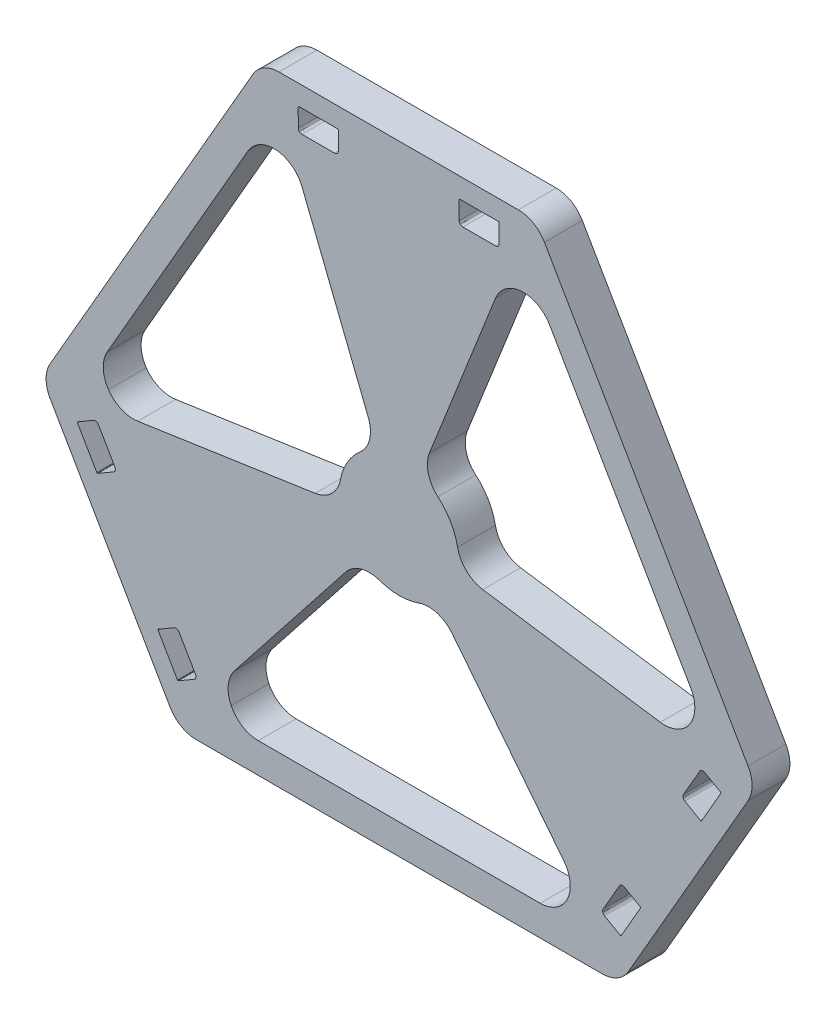
from build123d import *

# Parameters (mm, degrees)
SALIENTE_EXTRUIR1_DEPTH = 6


with BuildPart() as part:
    # Model → Saliente-Extruir1 (new body)
    with BuildSketch(Plane.XY):
        with BuildLine():
            Line((123.073716777, 150.594974991), (155.364474777, 94.802453991))
            add(Edge.make_bspline(
                [(155.369875777, 90.027377991), (156.220958777, 91.506312991), (156.220003777, 93.325664991), (155.364474777, 94.802453991)],
                knots=[0, 0, 0, 0, 1, 1, 1, 1], degree=3))
            Line((155.369875777, 90.027377991), (136.394857777, 57.081100991))
            add(Edge.make_bspline(
                [(132.258746777, 54.689013991), (133.966417777, 54.690033991), (135.542764777, 55.601093991), (136.394857777, 57.081100991)],
                knots=[0, 0, 0, 0, 1, 1, 1, 1], degree=3))
            Line((132.258746777, 54.689013991), (67.838026777, 54.661802991))
            add(Edge.make_bspline(
                [(63.702990777, 57.044915991), (64.557578777, 55.569169991), (66.132444777, 54.660742991), (67.838026777, 54.661802991)],
                knots=[0, 0, 0, 0, 1, 1, 1, 1], degree=3))
            Line((63.702990777, 57.044915991), (44.672617777, 89.925918991))
            add(Edge.make_bspline(
                [(44.667756777, 94.701021991), (43.816363777, 93.221867991), (43.817618777, 91.402648991), (44.672617777, 89.925918991)],
                knots=[0, 0, 0, 0, 1, 1, 1, 1], degree=3))
            Line((44.667756777, 94.701021991), (76.830723777, 150.545823991))
            add(Edge.make_bspline(
                [(80.963762777, 152.938289991), (79.256844777, 152.935967991), (77.682094777, 152.024965991), (76.830723777, 150.545823991)],
                knots=[0, 0, 0, 0, 1, 1, 1, 1], degree=3))
            Line((80.963762777, 152.938289991), (118.935657777, 152.978335991))
            add(Edge.make_bspline(
                [(123.073716777, 150.594974991), (122.218474777, 152.071971991), (120.642270777, 152.980480991), (118.935657777, 152.978335991)],
                knots=[0, 0, 0, 0, 1, 1, 1, 1], degree=3))
        make_face()
        with BuildLine():
            Line((77.681485777, 59.441134991), (122.387310777, 59.459893991))
            add(Edge.make_bspline(
                [(126.697512777, 62.165300991), (125.906296777, 60.516724991), (124.216028777, 59.465862991), (122.387310777, 59.459893991)],
                knots=[0, 0, 0, 0, 1, 1, 1, 1], degree=3))
            add(Edge.make_bspline(
                [(126.128344777, 67.200341991), (127.267996777, 65.769991991), (127.489033777, 63.814052991), (126.697512777, 62.165300991)],
                knots=[0, 0, 0, 0, 1, 1, 1, 1], degree=3))
            Line((126.128344777, 67.200341991), (108.441737777, 89.527436991))
            add(Edge.make_bspline(
                [(103.127906777, 91.071743991), (105.046522777, 91.740738991), (107.179880777, 91.119636991), (108.441737777, 89.527436991)],
                knots=[0, 0, 0, 0, 1, 1, 1, 1], degree=3))
            add(Edge.make_bspline(
                [(96.876021777, 91.081033991), (98.899345777, 90.369754991), (101.102765777, 90.366368991), (103.127906777, 91.071743991)],
                knots=[0, 0, 0, 0, 1, 1, 1, 1], degree=3))
            add(Edge.make_bspline(
                [(91.541311777, 89.530966991), (92.803750777, 91.135114991), (94.949988777, 91.757318991), (96.876021777, 91.081033991)],
                knots=[0, 0, 0, 0, 1, 1, 1, 1], degree=3))
            Line((91.541311777, 89.530966991), (73.928138777, 67.171368991))
            add(Edge.make_bspline(
                [(73.382054777, 62.115712991), (72.579715777, 63.757020991), (72.801400777, 65.732986991), (73.928138777, 67.171368991)],
                knots=[0, 0, 0, 0, 1, 1, 1, 1], degree=3))
            add(Edge.make_bspline(
                [(77.681485777, 59.441134991), (75.854393777, 59.435455991), (74.184692777, 60.474168991), (73.382054777, 62.115712991)],
                knots=[0, 0, 0, 0, 1, 1, 1, 1], degree=3))
        make_face(mode=Mode.SUBTRACT)
        with BuildLine():
            Line((58.568705777, 93.763253991), (86.715953777, 97.930982991))
            add(Edge.make_bspline(
                [(90.708621777, 101.767455991), (90.331813777, 99.769779991), (88.727234777, 98.229294991), (86.715953777, 97.930982991)],
                knots=[0, 0, 0, 0, 1, 1, 1, 1], degree=3))
            add(Edge.make_bspline(
                [(93.823645777, 107.175973991), (92.203805777, 105.776652991), (91.105979777, 103.871180991), (90.708621777, 101.767455991)],
                knots=[0, 0, 0, 0, 1, 1, 1, 1], degree=3))
            add(Edge.make_bspline(
                [(95.138871777, 112.555316991), (95.891105777, 110.666125991), (95.361735777, 108.505969991), (93.823645777, 107.175973991)],
                knots=[0, 0, 0, 0, 1, 1, 1, 1], degree=3))
            Line((95.138871777, 112.555316991), (84.617766777, 138.992746991))
            add(Edge.make_bspline(
                [(80.511673777, 141.999081991), (82.336308777, 141.872661991), (83.936995777, 140.690148991), (84.617766777, 138.992746991)],
                knots=[0, 0, 0, 0, 1, 1, 1, 1], degree=3))
            add(Edge.make_bspline(
                [(76.043299777, 139.610630991), (76.951616777, 141.197728991), (78.687519777, 142.125372991), (80.511673777, 141.999081991)],
                knots=[0, 0, 0, 0, 1, 1, 1, 1], degree=3))
            Line((76.043299777, 139.610630991), (53.731287777, 100.870303991))
            add(Edge.make_bspline(
                [(53.922329777, 95.784755991), (52.889274777, 97.293756991), (52.822817777, 99.283116991), (53.731287777, 100.870303991)],
                knots=[0, 0, 0, 0, 1, 1, 1, 1], degree=3))
            add(Edge.make_bspline(
                [(58.568705777, 93.763253991), (56.760289777, 93.490642991), (54.955385777, 94.275754991), (53.922329777, 95.784755991)],
                knots=[0, 0, 0, 0, 1, 1, 1, 1], degree=3))
        make_face(mode=Mode.SUBTRACT)
        with BuildLine():
            Line((115.310927777, 139.025350991), (104.846212777, 112.565382991))
            add(Edge.make_bspline(
                [(106.176293777, 107.186096991), (104.631705777, 108.511130991), (104.098507777, 110.672605991), (104.846212777, 112.565382991)],
                knots=[0, 0, 0, 0, 1, 1, 1, 1], degree=3))
            add(Edge.make_bspline(
                [(109.300161777, 101.815386991), (108.892803777, 103.906624991), (107.793166777, 105.798143991), (106.176293777, 107.186096991)],
                knots=[0, 0, 0, 0, 1, 1, 1, 1], degree=3))
            add(Edge.make_bspline(
                [(113.291110777, 98.003018991), (111.287236777, 98.297572991), (109.687303777, 99.827392991), (109.300161777, 101.815386991)],
                knots=[0, 0, 0, 0, 1, 1, 1, 1], degree=3))
            Line((113.291110777, 98.003018991), (141.449392777, 93.852301991))
            add(Edge.make_bspline(
                [(146.110980777, 95.901281991), (145.087483777, 94.384311991), (143.260657777, 93.590523991), (141.449392777, 93.852301991)],
                knots=[0, 0, 0, 0, 1, 1, 1, 1], degree=3))
            add(Edge.make_bspline(
                [(146.278499777, 100.968458991), (147.199723777, 99.387315991), (147.134406777, 97.418372991), (146.110980777, 95.901281991)],
                knots=[0, 0, 0, 0, 1, 1, 1, 1], degree=3))
            Line((146.278499777, 100.968458991), (123.884522777, 139.661154991))
            add(Edge.make_bspline(
                [(119.384710777, 142.038537991), (121.208225777, 142.178856991), (122.964168777, 141.241496991), (123.884522777, 139.661154991)],
                knots=[0, 0, 0, 0, 1, 1, 1, 1], degree=3))
            add(Edge.make_bspline(
                [(115.310927777, 139.025350991), (115.979211777, 140.727870991), (117.561501777, 141.898395991), (119.384710777, 142.038537991)],
                knots=[0, 0, 0, 0, 1, 1, 1, 1], degree=3))
        make_face(mode=Mode.SUBTRACT)
        with BuildLine():
            Line((64.328403777, 68.276009991), (61.844260777, 66.838274991))
            add(Edge.make_bspline(
                [(61.785234777, 66.760906991), (61.793733777, 66.793542991), (61.815163777, 66.821434991), (61.844260777, 66.838274991)],
                knots=[0, 0, 0, 0, 1, 1, 1, 1], degree=3))
            add(Edge.make_bspline(
                [(61.797916777, 66.664715991), (61.781129777, 66.693721991), (61.776736777, 66.728271991), (61.785234777, 66.760906991)],
                knots=[0, 0, 0, 0, 1, 1, 1, 1], degree=3))
            Line((61.797916777, 66.664715991), (64.851513777, 61.388659991))
            add(Edge.make_bspline(
                [(64.928897777, 61.329507991), (64.896246777, 61.338328991), (64.868596777, 61.359417991), (64.851513777, 61.388659991)],
                knots=[0, 0, 0, 0, 1, 1, 1, 1], degree=3))
            add(Edge.make_bspline(
                [(65.025090777, 61.342383991), (64.995992777, 61.325542991), (64.961547777, 61.320687991), (64.928897777, 61.329507991)],
                knots=[0, 0, 0, 0, 1, 1, 1, 1], degree=3))
            Line((65.025090777, 61.342383991), (67.509233777, 62.780118991))
            add(Edge.make_bspline(
                [(67.781432777, 63.135344991), (67.741531777, 62.985894991), (67.643272777, 62.857695991), (67.509233777, 62.780118991)],
                knots=[0, 0, 0, 0, 1, 1, 1, 1], degree=3))
            add(Edge.make_bspline(
                [(67.722280777, 63.578411991), (67.799857777, 63.444373991), (67.821187777, 63.285117991), (67.781432777, 63.135344991)],
                knots=[0, 0, 0, 0, 1, 1, 1, 1], degree=3))
            Line((67.722280777, 63.578411991), (65.126723777, 68.063059991))
            add(Edge.make_bspline(
                [(64.771379777, 68.335109991), (64.921141777, 68.295021991), (65.049024777, 68.197027991), (65.126723777, 68.063059991)],
                knots=[0, 0, 0, 0, 1, 1, 1, 1], degree=3))
            add(Edge.make_bspline(
                [(64.328403777, 68.276009991), (64.462442777, 68.353586991), (64.621763777, 68.374873991), (64.771379777, 68.335109991)],
                knots=[0, 0, 0, 0, 1, 1, 1, 1], degree=3))
        make_face(mode=Mode.SUBTRACT)
        with BuildLine():
            Line((51.541468777, 90.369494991), (49.057325777, 88.931759991))
            add(Edge.make_bspline(
                [(48.998299777, 88.854391991), (49.006797777, 88.887026991), (49.028227777, 88.914918991), (49.057325777, 88.931759991)],
                knots=[0, 0, 0, 0, 1, 1, 1, 1], degree=3))
            add(Edge.make_bspline(
                [(49.010981777, 88.758200991), (48.994193777, 88.787206991), (48.989505777, 88.821991991), (48.998299777, 88.854391991)],
                knots=[0, 0, 0, 0, 1, 1, 1, 1], degree=3))
            Line((49.010981777, 88.758200991), (52.064578777, 83.482144991))
            add(Edge.make_bspline(
                [(52.141842777, 83.422923991), (52.109488777, 83.431507991), (52.081542777, 83.452832991), (52.064578777, 83.482144991)],
                knots=[0, 0, 0, 0, 1, 1, 1, 1], degree=3))
            add(Edge.make_bspline(
                [(52.238155777, 83.435867991), (52.209057777, 83.419026991), (52.174435777, 83.414477991), (52.141842777, 83.422923991)],
                knots=[0, 0, 0, 0, 1, 1, 1, 1], degree=3))
            Line((52.238155777, 83.435867991), (54.722298777, 84.873602991))
            add(Edge.make_bspline(
                [(54.994497777, 85.228829991), (54.954474777, 85.079308991), (54.856337777, 84.951179991), (54.722298777, 84.873602991)],
                knots=[0, 0, 0, 0, 1, 1, 1, 1], degree=3))
            add(Edge.make_bspline(
                [(54.935345777, 85.671896991), (55.012922777, 85.537857991), (55.034252777, 85.378602991), (54.994497777, 85.228829991)],
                knots=[0, 0, 0, 0, 1, 1, 1, 1], degree=3))
            Line((54.935345777, 85.671896991), (52.339788777, 90.156543991))
            add(Edge.make_bspline(
                [(51.984444777, 90.428593991), (52.134029777, 90.388811991), (52.262265777, 90.290206991), (52.339788777, 90.156543991)],
                knots=[0, 0, 0, 0, 1, 1, 1, 1], degree=3))
            add(Edge.make_bspline(
                [(51.541468777, 90.369494991), (51.675507777, 90.447071991), (51.834828777, 90.468358991), (51.984444777, 90.428593991)],
                knots=[0, 0, 0, 0, 1, 1, 1, 1], degree=3))
        make_face(mode=Mode.SUBTRACT)
        with BuildLine():
            Line((115.904166777, 146.807848991), (115.901119777, 149.678052991))
            add(Edge.make_bspline(
                [(115.863692777, 149.768074991), (115.887277777, 149.744225991), (115.901108777, 149.711877991), (115.901119777, 149.678052991)],
                knots=[0, 0, 0, 0, 1, 1, 1, 1], degree=3))
            add(Edge.make_bspline(
                [(115.773874777, 149.804947991), (115.807521777, 149.805264991), (115.839801777, 149.791746991), (115.863692777, 149.768074991)],
                knots=[0, 0, 0, 0, 1, 1, 1, 1], degree=3))
            Line((115.773874777, 149.804947991), (109.677852777, 149.798469991))
            add(Edge.make_bspline(
                [(109.588136777, 149.761218991), (109.611808777, 149.785109991), (109.644028777, 149.798457991), (109.677852777, 149.798469991)],
                knots=[0, 0, 0, 0, 1, 1, 1, 1], degree=3))
            add(Edge.make_bspline(
                [(109.550957777, 149.671223991), (109.550946777, 149.705047991), (109.564158777, 149.737150991), (109.588136777, 149.761218991)],
                knots=[0, 0, 0, 0, 1, 1, 1, 1], degree=3))
            Line((109.550957777, 149.671223991), (109.554004777, 146.801019991))
            add(Edge.make_bspline(
                [(109.725753777, 146.388065991), (109.616019777, 146.497379991), (109.554288777, 146.646295991), (109.554004777, 146.801019991)],
                knots=[0, 0, 0, 0, 1, 1, 1, 1], degree=3))
            add(Edge.make_bspline(
                [(110.138580777, 146.217762991), (109.983855777, 146.217478991), (109.835486777, 146.278752991), (109.725753777, 146.388065991)],
                knots=[0, 0, 0, 0, 1, 1, 1, 1], degree=3))
            Line((110.138580777, 146.217762991), (115.320298777, 146.222919991))
            add(Edge.make_bspline(
                [(115.733558777, 146.394845991), (115.624244777, 146.285111991), (115.475328777, 146.223380991), (115.320298777, 146.222919991)],
                knots=[0, 0, 0, 0, 1, 1, 1, 1], degree=3))
            add(Edge.make_bspline(
                [(115.904166777, 146.807848991), (115.904145777, 146.652947991), (115.842871777, 146.504578991), (115.733558777, 146.394845991)],
                knots=[0, 0, 0, 0, 1, 1, 1, 1], degree=3))
        make_face(mode=Mode.SUBTRACT)
        with BuildLine():
            Line((90.377057777, 146.780709991), (90.374010777, 149.650913991))
            add(Edge.make_bspline(
                [(90.336583777, 149.740934991), (90.360474777, 149.717262991), (90.373999777, 149.684737991), (90.374010777, 149.650913991)],
                knots=[0, 0, 0, 0, 1, 1, 1, 1], degree=3))
            add(Edge.make_bspline(
                [(90.246764777, 149.777808991), (90.280412777, 149.778124991), (90.312997777, 149.764783991), (90.336583777, 149.740934991)],
                knots=[0, 0, 0, 0, 1, 1, 1, 1], degree=3))
            Line((90.246764777, 149.777808991), (84.150743777, 149.771329991))
            add(Edge.make_bspline(
                [(84.061027777, 149.734078991), (84.084699777, 149.757969991), (84.117224777, 149.771495991), (84.150743777, 149.771329991)],
                knots=[0, 0, 0, 0, 1, 1, 1, 1], degree=3))
            add(Edge.make_bspline(
                [(84.024153777, 149.644260991), (84.023837777, 149.677908991), (84.037355777, 149.710188991), (84.061027777, 149.734078991)],
                knots=[0, 0, 0, 0, 1, 1, 1, 1], degree=3))
            Line((84.024153777, 149.644260991), (84.027200777, 146.774056991))
            add(Edge.make_bspline(
                [(84.198644777, 146.360926991), (84.089087777, 146.469934991), (84.027179777, 146.619155991), (84.027200777, 146.774056991)],
                knots=[0, 0, 0, 0, 1, 1, 1, 1], degree=3))
            add(Edge.make_bspline(
                [(84.611953777, 146.190494991), (84.457228777, 146.190210991), (84.308377777, 146.251612991), (84.198644777, 146.360926991)],
                knots=[0, 0, 0, 0, 1, 1, 1, 1], degree=3))
            Line((84.611953777, 146.190494991), (89.793318777, 146.196262991))
            add(Edge.make_bspline(
                [(90.206754777, 146.367882991), (90.097440777, 146.258148991), (89.948219777, 146.196241991), (89.793318777, 146.196262991)],
                knots=[0, 0, 0, 0, 1, 1, 1, 1], degree=3))
            add(Edge.make_bspline(
                [(90.377057777, 146.780709991), (90.377341777, 146.625984991), (90.315762777, 146.477439991), (90.206754777, 146.367882991)],
                knots=[0, 0, 0, 0, 1, 1, 1, 1], degree=3))
        make_face(mode=Mode.SUBTRACT)
        with BuildLine():
            Line((145.340180777, 84.969758991), (147.827317777, 83.537381991))
            add(Edge.make_bspline(
                [(147.923566777, 83.524609991), (147.891129777, 83.515863991), (147.856299777, 83.520405991), (147.827317777, 83.537381991)],
                knots=[0, 0, 0, 0, 1, 1, 1, 1], degree=3))
            add(Edge.make_bspline(
                [(148.000559777, 83.583844991), (147.983951777, 83.554789991), (147.956379777, 83.533411991), (147.923566777, 83.524609991)],
                knots=[0, 0, 0, 0, 1, 1, 1, 1], degree=3))
            Line((148.000559777, 83.583844991), (151.042948777, 88.866439991))
            add(Edge.make_bspline(
                [(151.055596777, 88.962902991), (151.064543777, 88.930540991), (151.059861777, 88.895671991), (151.042948777, 88.866439991)],
                knots=[0, 0, 0, 0, 1, 1, 1, 1], degree=3))
            add(Edge.make_bspline(
                [(150.996344777, 89.039925991), (151.025632777, 89.023126991), (151.046936777, 88.995471991), (151.055596777, 88.962902991)],
                knots=[0, 0, 0, 0, 1, 1, 1, 1], degree=3))
            Line((150.996344777, 89.039925991), (148.509207777, 90.472303991))
            add(Edge.make_bspline(
                [(148.065502777, 90.530456991), (148.214748777, 90.570490991), (148.374867777, 90.549481991), (148.509207777, 90.472303991)],
                knots=[0, 0, 0, 0, 1, 1, 1, 1], degree=3))
            add(Edge.make_bspline(
                [(147.711434777, 90.257668991), (147.788581777, 90.391991991), (147.915805777, 90.489794991), (148.065502777, 90.530456991)],
                knots=[0, 0, 0, 0, 1, 1, 1, 1], degree=3))
            Line((147.711434777, 90.257668991), (145.125091777, 85.767472991))
            add(Edge.make_bspline(
                [(145.067562777, 85.323884991), (145.027173777, 85.473251991), (145.048231777, 85.633357991), (145.125091777, 85.767472991)],
                knots=[0, 0, 0, 0, 1, 1, 1, 1], degree=3))
            add(Edge.make_bspline(
                [(145.340180777, 84.969758991), (145.205840777, 85.046936991), (145.107734777, 85.174189991), (145.067562777, 85.323884991)],
                knots=[0, 0, 0, 0, 1, 1, 1, 1], degree=3))
        make_face(mode=Mode.SUBTRACT)
        with BuildLine():
            Line((132.600024777, 62.849104991), (135.087231777, 61.416604991))
            add(Edge.make_bspline(
                [(135.183715777, 61.404132991), (135.151260777, 61.395416991), (135.116448777, 61.399928991), (135.087231777, 61.416604991)],
                knots=[0, 0, 0, 0, 1, 1, 1, 1], degree=3))
            add(Edge.make_bspline(
                [(135.260708777, 61.463366991), (135.243795777, 61.434135991), (135.216152777, 61.412878991), (135.183715777, 61.404132991)],
                knots=[0, 0, 0, 0, 1, 1, 1, 1], degree=3))
            Line((135.260708777, 61.463366991), (138.303097777, 66.745961991))
            add(Edge.make_bspline(
                [(138.315728777, 66.842455991), (138.324387777, 66.809886991), (138.319705777, 66.775016991), (138.303097777, 66.745961991)],
                knots=[0, 0, 0, 0, 1, 1, 1, 1], degree=3))
            add(Edge.make_bspline(
                [(138.256259777, 66.919149991), (138.285475777, 66.902472991), (138.306762777, 66.874847991), (138.315728777, 66.842455991)],
                knots=[0, 0, 0, 0, 1, 1, 1, 1], degree=3))
            Line((138.256259777, 66.919149991), (135.769051777, 68.351648991))
            add(Edge.make_bspline(
                [(135.325417777, 68.409679991), (135.474826777, 68.450134991), (135.635016777, 68.429003991), (135.769051777, 68.351648991)],
                knots=[0, 0, 0, 0, 1, 1, 1, 1], degree=3))
            add(Edge.make_bspline(
                [(134.971260777, 68.137044991), (135.048496777, 68.271214991), (135.175936777, 68.369347991), (135.325417777, 68.409679991)],
                knots=[0, 0, 0, 0, 1, 1, 1, 1], degree=3))
            Line((134.971260777, 68.137044991), (132.385310777, 63.646873991))
            add(Edge.make_bspline(
                [(132.327406777, 63.203230991), (132.286946777, 63.352718991), (132.308074777, 63.512702991), (132.385310777, 63.646873991)],
                knots=[0, 0, 0, 0, 1, 1, 1, 1], degree=3))
            add(Edge.make_bspline(
                [(132.600024777, 62.849104991), (132.465683777, 62.926282991), (132.367866777, 63.053742991), (132.327406777, 63.203230991)],
                knots=[0, 0, 0, 0, 1, 1, 1, 1], degree=3))
        make_face(mode=Mode.SUBTRACT)
    extrude(amount=SALIENTE_EXTRUIR1_DEPTH)


solid = part.part
